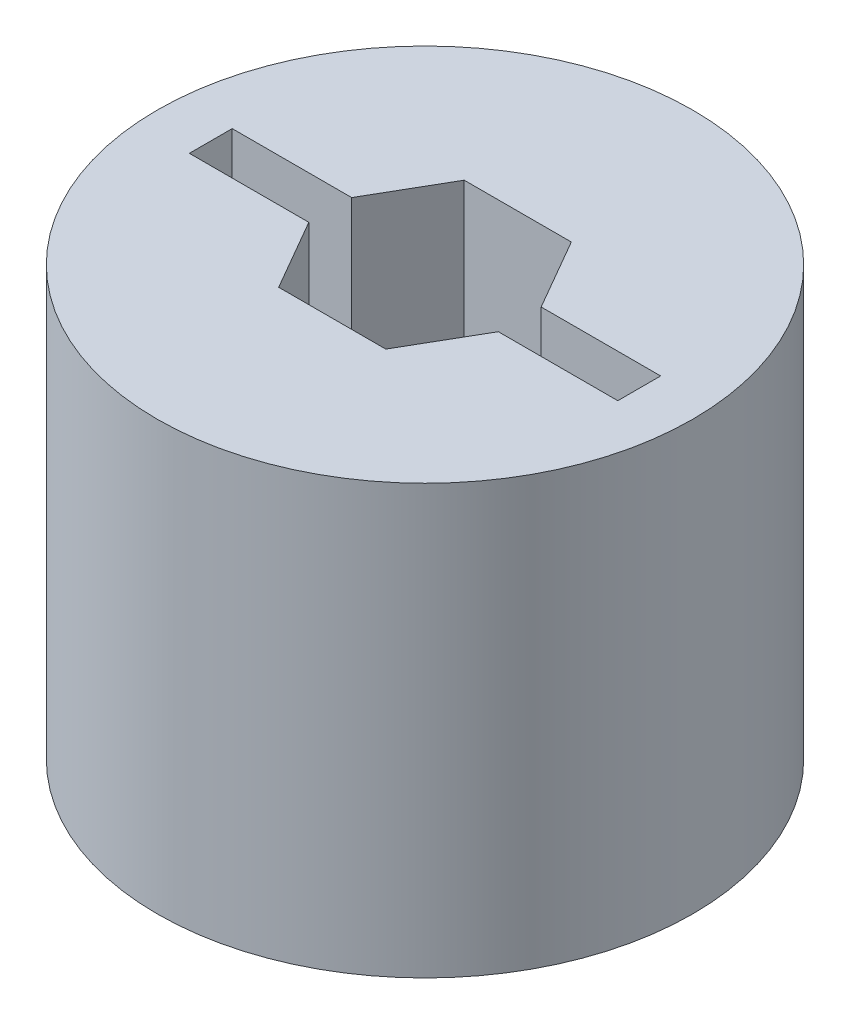
from build123d import *

# Parameters (mm, degrees)
SKETCH1_R           = 15.875
BOSS_EXTRUDE1_DEPTH = 25.4
CUT_EXTRUDE1_DEPTH  = 34.89972345


with BuildPart() as part:
    # Sketch1 → Boss-Extrude1 (new body)
    with BuildSketch(Plane(origin=(0, 0, 0), x_dir=(1, 0, 0), z_dir=(0, 1, 0))):
        with Locations(Location((0, 0, 0), (0, 0, 90))):
            Circle(SKETCH1_R)
    extrude(amount=BOSS_EXTRUDE1_DEPTH)

    # Sketch2 → Cut-Extrude1 (cut, through all)
    with BuildSketch(Plane(origin=(0, 25.4, 0), x_dir=(1, 0, 0), z_dir=(0, 1, 0))):
        Polygon((-6.35, 0), (-5.616765158, 1.27), (-12.7, 1.27), (-12.7, -1.27), (-5.616765158, -1.27), align=None)
        Polygon((3.175, -5.499261314), (5.616765158, -1.27), (-5.616765158, -1.27), (-3.175, -5.499261314), align=None)
        Polygon((6.35, 0), (5.616765158, 1.27), (-5.616765158, 1.27), (-6.35, 0), (-5.616765158, -1.27), (5.616765158, -1.27), align=None)
        Polygon((5.616765158, 1.27), (3.175, 5.499261314), (-3.175, 5.499261314), (-5.616765158, 1.27), align=None)
        Polygon((12.7, 1.27), (5.616765158, 1.27), (6.35, 0), (5.616765158, -1.27), (12.7, -1.27), align=None)
    extrude(amount=-CUT_EXTRUDE1_DEPTH, mode=Mode.SUBTRACT)


solid = part.part
